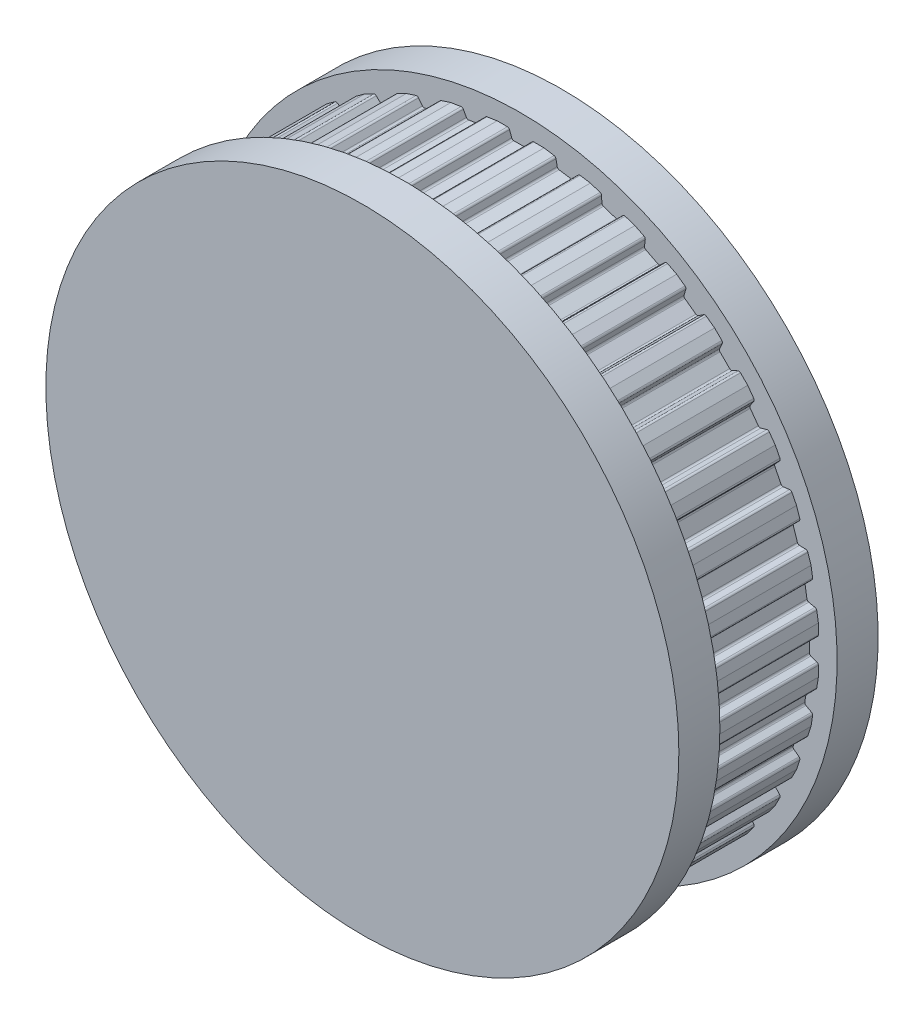
from build123d import *

# Parameters (mm, degrees)
BOSS_EXTRUDE1_DEPTH = 5
SKETCH3_R           = 13.5
BOSS_EXTRUDE2_DEPTH = 1.75
BOSS_EXTRUDE3_START = 1.75
SKETCH4_R           = 13.5
BOSS_EXTRUDE3_DEPTH = 1.75


with BuildPart() as part:
    # Sketch1 → Boss-Extrude1 (new body)
    with BuildSketch(Plane.XY):
        with BuildLine():
            Line((-50.783511677, 0), (-50.346633156, 0))
            ThreePointArc((-50.346633156, 0), (-50.292, 0.017225768), (-50.257127433, 0.062672581))
            Line((-50.257127433, 0.062672581), (-50.164076682, 0.318327419))
            ThreePointArc((-50.164076682, 0.318327419), (-50.129204116, 0.363774232), (-50.07457096, 0.381))
            Line((-50.07457096, 0.381), (-49.49342904, 0.381))
            ThreePointArc((-49.49342904, 0.381), (-49.438795884, 0.363774232), (-49.403923318, 0.318327419))
            Line((-49.403923318, 0.318327419), (-49.310872567, 0.062672581))
            ThreePointArc((-49.310872567, 0.062672581), (-49.276, 0.017225768), (-49.221366844, 0))
            Line((-49.221366844, 0), (-48.784488323, 0))
            Line((-48.784488323, 0), (-48.352988502, 0.068342858))
            ThreePointArc((-48.352988502, 0.068342858), (-48.301722675, 0.093903056), (-48.274388895, 0.144245615))
            Line((-48.274388895, 0.144245615), (-48.222476981, 0.411309262))
            ThreePointArc((-48.222476981, 0.411309262), (-48.195143202, 0.461651821), (-48.143877375, 0.487212019))
            Line((-48.143877375, 0.487212019), (-47.569890276, 0.578122645))
            ThreePointArc((-47.569890276, 0.578122645), (-47.513235041, 0.569655463), (-47.471682366, 0.530223447))
            Line((-47.471682366, 0.530223447), (-47.339783996, 0.292272489))
            ThreePointArc((-47.339783996, 0.292272489), (-47.298231321, 0.252840473), (-47.241576086, 0.244373291))
            Line((-47.241576086, 0.244373291), (-46.810076265, 0.312716149))
            Line((-46.810076265, 0.312716149), (-46.3945801, 0.447719036))
            ThreePointArc((-46.3945801, 0.447719036), (-46.347943937, 0.480984289), (-46.328821993, 0.534982993))
            Line((-46.328821993, 0.534982993), (-46.319327159, 0.806879455))
            ThreePointArc((-46.319327159, 0.806879455), (-46.300205215, 0.860878159), (-46.253569052, 0.894143411))
            Line((-46.253569052, 0.894143411), (-45.700870241, 1.073726141))
            ThreePointArc((-45.700870241, 1.073726141), (-45.643587967, 1.074226035), (-45.596378348, 1.041779763))
            Line((-45.596378348, 1.041779763), (-45.428880136, 0.827391827))
            ThreePointArc((-45.428880136, 0.827391827), (-45.381670516, 0.794945555), (-45.324388243, 0.79544545))
            Line((-45.324388243, 0.79544545), (-44.908892078, 0.930448337))
            Line((-44.908892078, 0.930448337), (-44.519630466, 1.128787035))
            ThreePointArc((-44.519630466, 1.128787035), (-44.478772303, 1.16893824), (-44.46833304, 1.225263462))
            Line((-44.46833304, 1.225263462), (-44.501489081, 1.495297747))
            ThreePointArc((-44.501489081, 1.495297747), (-44.491049818, 1.551622968), (-44.450191655, 1.591774173))
            Line((-44.450191655, 1.591774173), (-43.932390412, 1.855607084))
            ThreePointArc((-43.932390412, 1.855607084), (-43.875891579, 1.865061746), (-43.824187473, 1.840400153))
            Line((-43.824187473, 1.840400153), (-43.62521378, 1.654854182))
            ThreePointArc((-43.62521378, 1.654854182), (-43.573509674, 1.630192588), (-43.517010841, 1.63964725))
            Line((-43.517010841, 1.63964725), (-43.127749228, 1.837985948))
            Line((-43.127749228, 1.837985948), (-42.77430708, 2.0947767))
            ThreePointArc((-42.77430708, 2.0947767), (-42.740232981, 2.140825202), (-42.738733449, 2.198090027))
            Line((-42.738733449, 2.198090027), (-42.813723953, 2.459612994))
            ThreePointArc((-42.813723953, 2.459612994), (-42.812224421, 2.516877819), (-42.778150322, 2.562926321))
            Line((-42.778150322, 2.562926321), (-42.307996632, 2.904512971))
            ThreePointArc((-42.307996632, 2.904512971), (-42.253672429, 2.922689596), (-42.198746963, 2.906419932))
            Line((-42.198746963, 2.906419932), (-41.973197181, 2.754284683))
            ThreePointArc((-41.973197181, 2.754284683), (-41.918271715, 2.738015018), (-41.863947511, 2.756191643))
            Line((-41.863947511, 2.756191643), (-41.510505363, 3.012982394))
            Line((-41.510505363, 3.012982394), (-41.201585599, 3.321902159))
            ThreePointArc((-41.201585599, 3.321902159), (-41.175134581, 3.372714091), (-41.182611703, 3.42950847))
            Line((-41.182611703, 3.42950847), (-41.297590155, 3.676080556))
            ThreePointArc((-41.297590155, 3.676080556), (-41.305067277, 3.732874934), (-41.278616259, 3.783686866))
            Line((-41.278616259, 3.783686866), (-40.867686866, 4.194616259))
            ThreePointArc((-40.867686866, 4.194616259), (-40.816874934, 4.221067277), (-40.760080556, 4.213590155))
            Line((-40.760080556, 4.213590155), (-40.51350847, 4.098611703))
            ThreePointArc((-40.51350847, 4.098611703), (-40.456714091, 4.091134581), (-40.405902159, 4.117585599))
            Line((-40.405902159, 4.117585599), (-40.096982394, 4.426505363))
            Line((-40.096982394, 4.426505363), (-39.840191643, 4.779947511))
            ThreePointArc((-39.840191643, 4.779947511), (-39.822015018, 4.834271715), (-39.838284683, 4.889197181))
            Line((-39.838284683, 4.889197181), (-39.990419932, 5.114746963))
            ThreePointArc((-39.990419932, 5.114746963), (-40.006689596, 5.169672429), (-39.988512971, 5.223996632))
            Line((-39.988512971, 5.223996632), (-39.646926321, 5.694150322))
            ThreePointArc((-39.646926321, 5.694150322), (-39.600877819, 5.728224421), (-39.543612994, 5.729723953))
            Line((-39.543612994, 5.729723953), (-39.282090027, 5.654733449))
            ThreePointArc((-39.282090027, 5.654733449), (-39.224825202, 5.656232981), (-39.1787767, 5.69030708))
            Line((-39.1787767, 5.69030708), (-38.921985948, 6.043749228))
            Line((-38.921985948, 6.043749228), (-38.72364725, 6.433010841))
            ThreePointArc((-38.72364725, 6.433010841), (-38.714192588, 6.489509674), (-38.738854182, 6.54121378))
            Line((-38.738854182, 6.54121378), (-38.924400153, 6.740187473))
            ThreePointArc((-38.924400153, 6.740187473), (-38.949061746, 6.791891579), (-38.939607084, 6.848390412))
            Line((-38.939607084, 6.848390412), (-38.675774173, 7.366191655))
            ThreePointArc((-38.675774173, 7.366191655), (-38.635622968, 7.407049818), (-38.579297747, 7.417489081))
            Line((-38.579297747, 7.417489081), (-38.309263462, 7.38433304))
            ThreePointArc((-38.309263462, 7.38433304), (-38.25293824, 7.394772303), (-38.212787035, 7.435630466))
            Line((-38.212787035, 7.435630466), (-38.014448337, 7.824892078))
            Line((-38.014448337, 7.824892078), (-37.87944545, 8.240388243))
            ThreePointArc((-37.87944545, 8.240388243), (-37.878945555, 8.297670516), (-37.911391827, 8.344880136))
            Line((-37.911391827, 8.344880136), (-38.125779763, 8.512378348))
            ThreePointArc((-38.125779763, 8.512378348), (-38.158226035, 8.559587967), (-38.157726141, 8.616870241))
            Line((-38.157726141, 8.616870241), (-37.978143411, 9.169569052))
            ThreePointArc((-37.978143411, 9.169569052), (-37.944878159, 9.216205215), (-37.890879455, 9.235327159))
            Line((-37.890879455, 9.235327159), (-37.618982993, 9.244821993))
            ThreePointArc((-37.618982993, 9.244821993), (-37.564984289, 9.263943937), (-37.531719036, 9.3105801))
            Line((-37.531719036, 9.3105801), (-37.396716149, 9.726076265))
            Line((-37.396716149, 9.726076265), (-37.328373291, 10.157576086))
            ThreePointArc((-37.328373291, 10.157576086), (-37.336840473, 10.214231321), (-37.376272489, 10.255783996))
            Line((-37.376272489, 10.255783996), (-37.614223447, 10.387682366))
            ThreePointArc((-37.614223447, 10.387682366), (-37.653655463, 10.429235041), (-37.662122645, 10.485890276))
            Line((-37.662122645, 10.485890276), (-37.571212019, 11.059877375))
            ThreePointArc((-37.571212019, 11.059877375), (-37.545651821, 11.111143202), (-37.495309262, 11.138476981))
            Line((-37.495309262, 11.138476981), (-37.228245615, 11.190388895))
            ThreePointArc((-37.228245615, 11.190388895), (-37.177903056, 11.217722675), (-37.152342858, 11.268988502))
            Line((-37.152342858, 11.268988502), (-37.084, 11.700488323))
            Line((-37.084, 11.700488323), (-37.084, 12.137366844))
            ThreePointArc((-37.084, 12.137366844), (-37.101225768, 12.192), (-37.146672581, 12.226872567))
            Line((-37.146672581, 12.226872567), (-37.402327419, 12.319923318))
            ThreePointArc((-37.402327419, 12.319923318), (-37.447774232, 12.354795884), (-37.465, 12.40942904))
            Line((-37.465, 12.40942904), (-37.465, 12.99057096))
            ThreePointArc((-37.465, 12.99057096), (-37.447774232, 13.045204116), (-37.402327419, 13.080076682))
            Line((-37.402327419, 13.080076682), (-37.146672581, 13.173127433))
            ThreePointArc((-37.146672581, 13.173127433), (-37.101225768, 13.208), (-37.084, 13.262633156))
            Line((-37.084, 13.262633156), (-37.084, 13.699511677))
            Line((-37.084, 13.699511677), (-37.152342858, 14.131011498))
            ThreePointArc((-37.152342858, 14.131011498), (-37.177903056, 14.182277325), (-37.228245615, 14.209611105))
            Line((-37.228245615, 14.209611105), (-37.495309262, 14.261523019))
            ThreePointArc((-37.495309262, 14.261523019), (-37.545651821, 14.288856798), (-37.571212019, 14.340122625))
            Line((-37.571212019, 14.340122625), (-37.662122645, 14.914109724))
            ThreePointArc((-37.662122645, 14.914109724), (-37.653655463, 14.970764959), (-37.614223447, 15.012317634))
            Line((-37.614223447, 15.012317634), (-37.376272489, 15.144216004))
            ThreePointArc((-37.376272489, 15.144216004), (-37.336840473, 15.185768679), (-37.328373291, 15.242423914))
            Line((-37.328373291, 15.242423914), (-37.396716149, 15.673923735))
            Line((-37.396716149, 15.673923735), (-37.531719036, 16.0894199))
            ThreePointArc((-37.531719036, 16.0894199), (-37.564984289, 16.136056063), (-37.618982993, 16.155178007))
            Line((-37.618982993, 16.155178007), (-37.890879455, 16.164672841))
            ThreePointArc((-37.890879455, 16.164672841), (-37.944878159, 16.183794785), (-37.978143411, 16.230430948))
            Line((-37.978143411, 16.230430948), (-38.157726141, 16.783129759))
            ThreePointArc((-38.157726141, 16.783129759), (-38.158226035, 16.840412033), (-38.125779763, 16.887621652))
            Line((-38.125779763, 16.887621652), (-37.911391827, 17.055119864))
            ThreePointArc((-37.911391827, 17.055119864), (-37.878945555, 17.102329484), (-37.87944545, 17.159611757))
            Line((-37.87944545, 17.159611757), (-38.014448337, 17.575107922))
            Line((-38.014448337, 17.575107922), (-38.212787035, 17.964369534))
            ThreePointArc((-38.212787035, 17.964369534), (-38.25293824, 18.005227697), (-38.309263462, 18.01566696))
            Line((-38.309263462, 18.01566696), (-38.579297747, 17.982510919))
            ThreePointArc((-38.579297747, 17.982510919), (-38.635622968, 17.992950182), (-38.675774173, 18.033808345))
            Line((-38.675774173, 18.033808345), (-38.939607084, 18.551609588))
            ThreePointArc((-38.939607084, 18.551609588), (-38.949061746, 18.608108421), (-38.924400153, 18.659812527))
            Line((-38.924400153, 18.659812527), (-38.738854182, 18.85878622))
            ThreePointArc((-38.738854182, 18.85878622), (-38.714192588, 18.910490326), (-38.72364725, 18.966989159))
            Line((-38.72364725, 18.966989159), (-38.921985948, 19.356250772))
            Line((-38.921985948, 19.356250772), (-39.1787767, 19.70969292))
            ThreePointArc((-39.1787767, 19.70969292), (-39.224825202, 19.743767019), (-39.282090027, 19.745266551))
            Line((-39.282090027, 19.745266551), (-39.543612994, 19.670276047))
            ThreePointArc((-39.543612994, 19.670276047), (-39.600877819, 19.671775579), (-39.646926321, 19.705849678))
            Line((-39.646926321, 19.705849678), (-39.988512971, 20.176003368))
            ThreePointArc((-39.988512971, 20.176003368), (-40.006689596, 20.230327571), (-39.990419932, 20.285253037))
            Line((-39.990419932, 20.285253037), (-39.838284683, 20.510802819))
            ThreePointArc((-39.838284683, 20.510802819), (-39.822015018, 20.565728285), (-39.840191643, 20.620052489))
            Line((-39.840191643, 20.620052489), (-40.096982394, 20.973494637))
            Line((-40.096982394, 20.973494637), (-40.405902159, 21.282414401))
            ThreePointArc((-40.405902159, 21.282414401), (-40.456714091, 21.308865419), (-40.51350847, 21.301388297))
            Line((-40.51350847, 21.301388297), (-40.760080556, 21.186409845))
            ThreePointArc((-40.760080556, 21.186409845), (-40.816874934, 21.178932723), (-40.867686866, 21.205383741))
            Line((-40.867686866, 21.205383741), (-41.278616259, 21.616313134))
            ThreePointArc((-41.278616259, 21.616313134), (-41.305067277, 21.667125066), (-41.297590155, 21.723919444))
            Line((-41.297590155, 21.723919444), (-41.182611703, 21.97049153))
            ThreePointArc((-41.182611703, 21.97049153), (-41.175134581, 22.027285909), (-41.201585599, 22.078097841))
            Line((-41.201585599, 22.078097841), (-41.510505363, 22.387017606))
            Line((-41.510505363, 22.387017606), (-41.863947511, 22.643808357))
            ThreePointArc((-41.863947511, 22.643808357), (-41.918271715, 22.661984982), (-41.973197181, 22.645715317))
            Line((-41.973197181, 22.645715317), (-42.198746963, 22.493580068))
            ThreePointArc((-42.198746963, 22.493580068), (-42.253672429, 22.477310404), (-42.307996632, 22.495487029))
            Line((-42.307996632, 22.495487029), (-42.778150322, 22.837073679))
            ThreePointArc((-42.778150322, 22.837073679), (-42.812224421, 22.883122181), (-42.813723953, 22.940387006))
            Line((-42.813723953, 22.940387006), (-42.738733449, 23.201909973))
            ThreePointArc((-42.738733449, 23.201909973), (-42.740232981, 23.259174798), (-42.77430708, 23.3052233))
            Line((-42.77430708, 23.3052233), (-43.127749228, 23.562014052))
            Line((-43.127749228, 23.562014052), (-43.517010841, 23.76035275))
            ThreePointArc((-43.517010841, 23.76035275), (-43.573509674, 23.769807412), (-43.62521378, 23.745145818))
            Line((-43.62521378, 23.745145818), (-43.824187473, 23.559599847))
            ThreePointArc((-43.824187473, 23.559599847), (-43.875891579, 23.534938254), (-43.932390412, 23.544392916))
            Line((-43.932390412, 23.544392916), (-44.450191655, 23.808225827))
            ThreePointArc((-44.450191655, 23.808225827), (-44.491049818, 23.848377032), (-44.501489081, 23.904702253))
            Line((-44.501489081, 23.904702253), (-44.46833304, 24.174736538))
            ThreePointArc((-44.46833304, 24.174736538), (-44.478772303, 24.23106176), (-44.519630466, 24.271212965))
            Line((-44.519630466, 24.271212965), (-44.908892078, 24.469551663))
            Line((-44.908892078, 24.469551663), (-45.324388243, 24.60455455))
            ThreePointArc((-45.324388243, 24.60455455), (-45.381670516, 24.605054445), (-45.428880136, 24.572608173))
            Line((-45.428880136, 24.572608173), (-45.596378348, 24.358220237))
            ThreePointArc((-45.596378348, 24.358220237), (-45.643587967, 24.325773965), (-45.700870241, 24.326273859))
            Line((-45.700870241, 24.326273859), (-46.253569052, 24.505856589))
            ThreePointArc((-46.253569052, 24.505856589), (-46.300205215, 24.539121841), (-46.319327159, 24.593120545))
            Line((-46.319327159, 24.593120545), (-46.328821993, 24.865017007))
            ThreePointArc((-46.328821993, 24.865017007), (-46.347943937, 24.919015711), (-46.3945801, 24.952280964))
            Line((-46.3945801, 24.952280964), (-46.810076265, 25.087283851))
            Line((-46.810076265, 25.087283851), (-47.241576086, 25.155626709))
            ThreePointArc((-47.241576086, 25.155626709), (-47.298231321, 25.147159527), (-47.339783996, 25.107727511))
            Line((-47.339783996, 25.107727511), (-47.471682366, 24.869776553))
            ThreePointArc((-47.471682366, 24.869776553), (-47.513235041, 24.830344537), (-47.569890276, 24.821877355))
            Line((-47.569890276, 24.821877355), (-48.143877375, 24.912787981))
            ThreePointArc((-48.143877375, 24.912787981), (-48.195143202, 24.938348179), (-48.222476981, 24.988690738))
            Line((-48.222476981, 24.988690738), (-48.274388895, 25.255754385))
            ThreePointArc((-48.274388895, 25.255754385), (-48.301722675, 25.306096944), (-48.352988502, 25.331657142))
            Line((-48.352988502, 25.331657142), (-48.784488323, 25.4))
            Line((-48.784488323, 25.4), (-49.221366844, 25.4))
            ThreePointArc((-49.221366844, 25.4), (-49.276, 25.382774232), (-49.310872567, 25.337327419))
            Line((-49.310872567, 25.337327419), (-49.403923318, 25.081672581))
            ThreePointArc((-49.403923318, 25.081672581), (-49.438795884, 25.036225768), (-49.49342904, 25.019))
            Line((-49.49342904, 25.019), (-50.07457096, 25.019))
            ThreePointArc((-50.07457096, 25.019), (-50.129204116, 25.036225768), (-50.164076682, 25.081672581))
            Line((-50.164076682, 25.081672581), (-50.257127433, 25.337327419))
            ThreePointArc((-50.257127433, 25.337327419), (-50.292, 25.382774232), (-50.346633156, 25.4))
            Line((-50.346633156, 25.4), (-50.783511677, 25.4))
            Line((-50.783511677, 25.4), (-51.215011498, 25.331657142))
            ThreePointArc((-51.215011498, 25.331657142), (-51.266277325, 25.306096944), (-51.293611105, 25.255754385))
            Line((-51.293611105, 25.255754385), (-51.345523019, 24.988690738))
            ThreePointArc((-51.345523019, 24.988690738), (-51.372856798, 24.938348179), (-51.424122625, 24.912787981))
            Line((-51.424122625, 24.912787981), (-51.998109724, 24.821877355))
            ThreePointArc((-51.998109724, 24.821877355), (-52.054764959, 24.830344537), (-52.096317634, 24.869776553))
            Line((-52.096317634, 24.869776553), (-52.228216004, 25.107727511))
            ThreePointArc((-52.228216004, 25.107727511), (-52.269768679, 25.147159527), (-52.326423914, 25.155626709))
            Line((-52.326423914, 25.155626709), (-52.757923735, 25.087283851))
            Line((-52.757923735, 25.087283851), (-53.1734199, 24.952280964))
            ThreePointArc((-53.1734199, 24.952280964), (-53.220056063, 24.919015711), (-53.239178007, 24.865017007))
            Line((-53.239178007, 24.865017007), (-53.248672841, 24.593120545))
            ThreePointArc((-53.248672841, 24.593120545), (-53.267794785, 24.539121841), (-53.314430948, 24.505856589))
            Line((-53.314430948, 24.505856589), (-53.867129759, 24.326273859))
            ThreePointArc((-53.867129759, 24.326273859), (-53.924412033, 24.325773965), (-53.971621652, 24.358220237))
            Line((-53.971621652, 24.358220237), (-54.139119864, 24.572608173))
            ThreePointArc((-54.139119864, 24.572608173), (-54.186329484, 24.605054445), (-54.243611757, 24.60455455))
            Line((-54.243611757, 24.60455455), (-54.659107922, 24.469551663))
            Line((-54.659107922, 24.469551663), (-55.048369534, 24.271212965))
            ThreePointArc((-55.048369534, 24.271212965), (-55.089227697, 24.23106176), (-55.09966696, 24.174736538))
            Line((-55.09966696, 24.174736538), (-55.066510919, 23.904702253))
            ThreePointArc((-55.066510919, 23.904702253), (-55.076950182, 23.848377032), (-55.117808345, 23.808225827))
            Line((-55.117808345, 23.808225827), (-55.635609588, 23.544392916))
            ThreePointArc((-55.635609588, 23.544392916), (-55.692108421, 23.534938254), (-55.743812527, 23.559599847))
            Line((-55.743812527, 23.559599847), (-55.94278622, 23.745145818))
            ThreePointArc((-55.94278622, 23.745145818), (-55.994490326, 23.769807412), (-56.050989159, 23.76035275))
            Line((-56.050989159, 23.76035275), (-56.440250772, 23.562014052))
            Line((-56.440250772, 23.562014052), (-56.79369292, 23.3052233))
            ThreePointArc((-56.79369292, 23.3052233), (-56.827767019, 23.259174798), (-56.829266551, 23.201909973))
            Line((-56.829266551, 23.201909973), (-56.754276047, 22.940387006))
            ThreePointArc((-56.754276047, 22.940387006), (-56.755775579, 22.883122181), (-56.789849678, 22.837073679))
            Line((-56.789849678, 22.837073679), (-57.260003368, 22.495487029))
            ThreePointArc((-57.260003368, 22.495487029), (-57.314327571, 22.477310404), (-57.369253037, 22.493580068))
            Line((-57.369253037, 22.493580068), (-57.594802819, 22.645715317))
            ThreePointArc((-57.594802819, 22.645715317), (-57.649728285, 22.661984982), (-57.704052489, 22.643808357))
            Line((-57.704052489, 22.643808357), (-58.057494637, 22.387017606))
            Line((-58.057494637, 22.387017606), (-58.366414401, 22.078097841))
            ThreePointArc((-58.366414401, 22.078097841), (-58.392865419, 22.027285909), (-58.385388297, 21.97049153))
            Line((-58.385388297, 21.97049153), (-58.270409845, 21.723919444))
            ThreePointArc((-58.270409845, 21.723919444), (-58.262932723, 21.667125066), (-58.289383741, 21.616313134))
            Line((-58.289383741, 21.616313134), (-58.700313134, 21.205383741))
            ThreePointArc((-58.700313134, 21.205383741), (-58.751125066, 21.178932723), (-58.807919444, 21.186409845))
            Line((-58.807919444, 21.186409845), (-59.05449153, 21.301388297))
            ThreePointArc((-59.05449153, 21.301388297), (-59.111285909, 21.308865419), (-59.162097841, 21.282414401))
            Line((-59.162097841, 21.282414401), (-59.471017606, 20.973494637))
            Line((-59.471017606, 20.973494637), (-59.727808357, 20.620052489))
            ThreePointArc((-59.727808357, 20.620052489), (-59.745984982, 20.565728285), (-59.729715317, 20.510802819))
            Line((-59.729715317, 20.510802819), (-59.577580068, 20.285253037))
            ThreePointArc((-59.577580068, 20.285253037), (-59.561310404, 20.230327571), (-59.579487029, 20.176003368))
            Line((-59.579487029, 20.176003368), (-59.921073679, 19.705849678))
            ThreePointArc((-59.921073679, 19.705849678), (-59.967122181, 19.671775579), (-60.024387006, 19.670276047))
            Line((-60.024387006, 19.670276047), (-60.285909973, 19.745266551))
            ThreePointArc((-60.285909973, 19.745266551), (-60.343174798, 19.743767019), (-60.3892233, 19.70969292))
            Line((-60.3892233, 19.70969292), (-60.646014052, 19.356250772))
            Line((-60.646014052, 19.356250772), (-60.84435275, 18.966989159))
            ThreePointArc((-60.84435275, 18.966989159), (-60.853807412, 18.910490326), (-60.829145818, 18.85878622))
            Line((-60.829145818, 18.85878622), (-60.643599847, 18.659812527))
            ThreePointArc((-60.643599847, 18.659812527), (-60.618938254, 18.608108421), (-60.628392916, 18.551609588))
            Line((-60.628392916, 18.551609588), (-60.892225827, 18.033808345))
            ThreePointArc((-60.892225827, 18.033808345), (-60.932377032, 17.992950182), (-60.988702253, 17.982510919))
            Line((-60.988702253, 17.982510919), (-61.258736538, 18.01566696))
            ThreePointArc((-61.258736538, 18.01566696), (-61.31506176, 18.005227697), (-61.355212965, 17.964369534))
            Line((-61.355212965, 17.964369534), (-61.553551663, 17.575107922))
            Line((-61.553551663, 17.575107922), (-61.68855455, 17.159611757))
            ThreePointArc((-61.68855455, 17.159611757), (-61.689054445, 17.102329484), (-61.656608173, 17.055119864))
            Line((-61.656608173, 17.055119864), (-61.442220237, 16.887621652))
            ThreePointArc((-61.442220237, 16.887621652), (-61.409773965, 16.840412033), (-61.410273859, 16.783129759))
            Line((-61.410273859, 16.783129759), (-61.589856589, 16.230430948))
            ThreePointArc((-61.589856589, 16.230430948), (-61.623121841, 16.183794785), (-61.677120545, 16.164672841))
            Line((-61.677120545, 16.164672841), (-61.949017007, 16.155178007))
            ThreePointArc((-61.949017007, 16.155178007), (-62.003015711, 16.136056063), (-62.036280964, 16.0894199))
            Line((-62.036280964, 16.0894199), (-62.171283851, 15.673923735))
            Line((-62.171283851, 15.673923735), (-62.239626709, 15.242423914))
            ThreePointArc((-62.239626709, 15.242423914), (-62.231159527, 15.185768679), (-62.191727511, 15.144216004))
            Line((-62.191727511, 15.144216004), (-61.953776553, 15.012317634))
            ThreePointArc((-61.953776553, 15.012317634), (-61.914344537, 14.970764959), (-61.905877355, 14.914109724))
            Line((-61.905877355, 14.914109724), (-61.996787981, 14.340122625))
            ThreePointArc((-61.996787981, 14.340122625), (-62.022348179, 14.288856798), (-62.072690738, 14.261523019))
            Line((-62.072690738, 14.261523019), (-62.339754385, 14.209611105))
            ThreePointArc((-62.339754385, 14.209611105), (-62.390096944, 14.182277325), (-62.415657142, 14.131011498))
            Line((-62.415657142, 14.131011498), (-62.484, 13.699511677))
            Line((-62.484, 13.699511677), (-62.484, 13.262633156))
            ThreePointArc((-62.484, 13.262633156), (-62.466774232, 13.208), (-62.421327419, 13.173127433))
            Line((-62.421327419, 13.173127433), (-62.165672581, 13.080076682))
            ThreePointArc((-62.165672581, 13.080076682), (-62.120225768, 13.045204116), (-62.103, 12.99057096))
            Line((-62.103, 12.99057096), (-62.103, 12.40942904))
            ThreePointArc((-62.103, 12.40942904), (-62.120225768, 12.354795884), (-62.165672581, 12.319923318))
            Line((-62.165672581, 12.319923318), (-62.421327419, 12.226872567))
            ThreePointArc((-62.421327419, 12.226872567), (-62.466774232, 12.192), (-62.484, 12.137366844))
            Line((-62.484, 12.137366844), (-62.484, 11.700488323))
            Line((-62.484, 11.700488323), (-62.415657142, 11.268988502))
            ThreePointArc((-62.415657142, 11.268988502), (-62.390096944, 11.217722675), (-62.339754385, 11.190388895))
            Line((-62.339754385, 11.190388895), (-62.072690738, 11.138476981))
            ThreePointArc((-62.072690738, 11.138476981), (-62.022348179, 11.111143202), (-61.996787981, 11.059877375))
            Line((-61.996787981, 11.059877375), (-61.905877355, 10.485890276))
            ThreePointArc((-61.905877355, 10.485890276), (-61.914344537, 10.429235041), (-61.953776553, 10.387682366))
            Line((-61.953776553, 10.387682366), (-62.191727511, 10.255783996))
            ThreePointArc((-62.191727511, 10.255783996), (-62.231159527, 10.214231321), (-62.239626709, 10.157576086))
            Line((-62.239626709, 10.157576086), (-62.171283851, 9.726076265))
            Line((-62.171283851, 9.726076265), (-62.036280964, 9.3105801))
            ThreePointArc((-62.036280964, 9.3105801), (-62.003015711, 9.263943937), (-61.949017007, 9.244821993))
            Line((-61.949017007, 9.244821993), (-61.677120545, 9.235327159))
            ThreePointArc((-61.677120545, 9.235327159), (-61.623121841, 9.216205215), (-61.589856589, 9.169569052))
            Line((-61.589856589, 9.169569052), (-61.410273859, 8.616870241))
            ThreePointArc((-61.410273859, 8.616870241), (-61.409773965, 8.559587967), (-61.442220237, 8.512378348))
            Line((-61.442220237, 8.512378348), (-61.656608173, 8.344880136))
            ThreePointArc((-61.656608173, 8.344880136), (-61.689054445, 8.297670516), (-61.68855455, 8.240388243))
            Line((-61.68855455, 8.240388243), (-61.553551663, 7.824892078))
            Line((-61.553551663, 7.824892078), (-61.355212965, 7.435630466))
            ThreePointArc((-61.355212965, 7.435630466), (-61.31506176, 7.394772303), (-61.258736538, 7.38433304))
            Line((-61.258736538, 7.38433304), (-60.988702253, 7.417489081))
            ThreePointArc((-60.988702253, 7.417489081), (-60.932377032, 7.407049818), (-60.892225827, 7.366191655))
            Line((-60.892225827, 7.366191655), (-60.628392916, 6.848390412))
            ThreePointArc((-60.628392916, 6.848390412), (-60.618938254, 6.791891579), (-60.643599847, 6.740187473))
            Line((-60.643599847, 6.740187473), (-60.829145818, 6.54121378))
            ThreePointArc((-60.829145818, 6.54121378), (-60.853807412, 6.489509674), (-60.84435275, 6.433010841))
            Line((-60.84435275, 6.433010841), (-60.646014052, 6.043749228))
            Line((-60.646014052, 6.043749228), (-60.3892233, 5.69030708))
            ThreePointArc((-60.3892233, 5.69030708), (-60.343174798, 5.656232981), (-60.285909973, 5.654733449))
            Line((-60.285909973, 5.654733449), (-60.024387006, 5.729723953))
            ThreePointArc((-60.024387006, 5.729723953), (-59.967122181, 5.728224421), (-59.921073679, 5.694150322))
            Line((-59.921073679, 5.694150322), (-59.579487029, 5.223996632))
            ThreePointArc((-59.579487029, 5.223996632), (-59.561310404, 5.169672429), (-59.577580068, 5.114746963))
            Line((-59.577580068, 5.114746963), (-59.729715317, 4.889197181))
            ThreePointArc((-59.729715317, 4.889197181), (-59.745984982, 4.834271715), (-59.727808357, 4.779947511))
            Line((-59.727808357, 4.779947511), (-59.471017606, 4.426505363))
            Line((-59.471017606, 4.426505363), (-59.162097841, 4.117585599))
            ThreePointArc((-59.162097841, 4.117585599), (-59.111285909, 4.091134581), (-59.05449153, 4.098611703))
            Line((-59.05449153, 4.098611703), (-58.807919444, 4.213590155))
            ThreePointArc((-58.807919444, 4.213590155), (-58.751125066, 4.221067277), (-58.700313134, 4.194616259))
            Line((-58.700313134, 4.194616259), (-58.289383741, 3.783686866))
            ThreePointArc((-58.289383741, 3.783686866), (-58.262932723, 3.732874934), (-58.270409845, 3.676080556))
            Line((-58.270409845, 3.676080556), (-58.385388297, 3.42950847))
            ThreePointArc((-58.385388297, 3.42950847), (-58.392865419, 3.372714091), (-58.366414401, 3.321902159))
            Line((-58.366414401, 3.321902159), (-58.057494637, 3.012982394))
            Line((-58.057494637, 3.012982394), (-57.704052489, 2.756191643))
            ThreePointArc((-57.704052489, 2.756191643), (-57.649728285, 2.738015018), (-57.594802819, 2.754284683))
            Line((-57.594802819, 2.754284683), (-57.369253037, 2.906419932))
            ThreePointArc((-57.369253037, 2.906419932), (-57.314327571, 2.922689596), (-57.260003368, 2.904512971))
            Line((-57.260003368, 2.904512971), (-56.789849678, 2.562926321))
            ThreePointArc((-56.789849678, 2.562926321), (-56.755775579, 2.516877819), (-56.754276047, 2.459612994))
            Line((-56.754276047, 2.459612994), (-56.829266551, 2.198090027))
            ThreePointArc((-56.829266551, 2.198090027), (-56.827767019, 2.140825202), (-56.79369292, 2.0947767))
            Line((-56.79369292, 2.0947767), (-56.440250772, 1.837985948))
            Line((-56.440250772, 1.837985948), (-56.050989159, 1.63964725))
            ThreePointArc((-56.050989159, 1.63964725), (-55.994490326, 1.630192588), (-55.94278622, 1.654854182))
            Line((-55.94278622, 1.654854182), (-55.743812527, 1.840400153))
            ThreePointArc((-55.743812527, 1.840400153), (-55.692108421, 1.865061746), (-55.635609588, 1.855607084))
            Line((-55.635609588, 1.855607084), (-55.117808345, 1.591774173))
            ThreePointArc((-55.117808345, 1.591774173), (-55.076950182, 1.551622968), (-55.066510919, 1.495297747))
            Line((-55.066510919, 1.495297747), (-55.09966696, 1.225263462))
            ThreePointArc((-55.09966696, 1.225263462), (-55.089227697, 1.16893824), (-55.048369534, 1.128787035))
            Line((-55.048369534, 1.128787035), (-54.659107922, 0.930448337))
            Line((-54.659107922, 0.930448337), (-54.243611757, 0.79544545))
            ThreePointArc((-54.243611757, 0.79544545), (-54.186329484, 0.794945555), (-54.139119864, 0.827391827))
            Line((-54.139119864, 0.827391827), (-53.971621652, 1.041779763))
            ThreePointArc((-53.971621652, 1.041779763), (-53.924412033, 1.074226035), (-53.867129759, 1.073726141))
            Line((-53.867129759, 1.073726141), (-53.314430948, 0.894143411))
            ThreePointArc((-53.314430948, 0.894143411), (-53.267794785, 0.860878159), (-53.248672841, 0.806879455))
            Line((-53.248672841, 0.806879455), (-53.239178007, 0.534982993))
            ThreePointArc((-53.239178007, 0.534982993), (-53.220056063, 0.480984289), (-53.1734199, 0.447719036))
            Line((-53.1734199, 0.447719036), (-52.757923735, 0.312716149))
            Line((-52.757923735, 0.312716149), (-52.326423914, 0.244373291))
            ThreePointArc((-52.326423914, 0.244373291), (-52.269768679, 0.252840473), (-52.228216004, 0.292272489))
            Line((-52.228216004, 0.292272489), (-52.096317634, 0.530223447))
            ThreePointArc((-52.096317634, 0.530223447), (-52.054764959, 0.569655463), (-51.998109724, 0.578122645))
            Line((-51.998109724, 0.578122645), (-51.424122625, 0.487212019))
            ThreePointArc((-51.424122625, 0.487212019), (-51.372856798, 0.461651821), (-51.345523019, 0.411309262))
            Line((-51.345523019, 0.411309262), (-51.293611105, 0.144245615))
            ThreePointArc((-51.293611105, 0.144245615), (-51.266277325, 0.093903056), (-51.215011498, 0.068342858))
            Line((-51.215011498, 0.068342858), (-50.783511677, 0))
        make_face()
    extrude(amount=BOSS_EXTRUDE1_DEPTH)

    # Sketch3 → Boss-Extrude2 (add)
    with BuildSketch(Plane.XY.offset(5)):
        with Locations((-49.784, 12.7)):
            Circle(SKETCH3_R)
    extrude(amount=BOSS_EXTRUDE2_DEPTH)

    # Sketch4 → Boss-Extrude3 (add)
    with BuildSketch(Plane(origin=(0, 0, 0), x_dir=(-1, 0, 0), z_dir=(0, 0, -1)).offset(BOSS_EXTRUDE3_START)):
        with Locations(Location((49.784, 12.7, 0), (0, 0, 180))):
            Circle(SKETCH4_R)
    extrude(amount=-BOSS_EXTRUDE3_DEPTH)


solid = part.part
